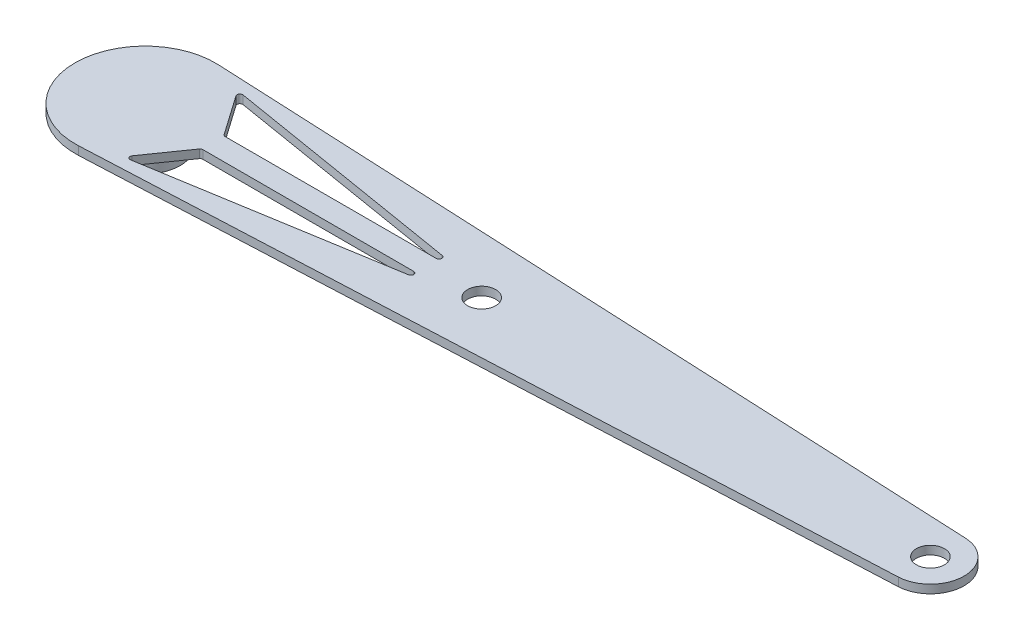
from build123d import *

# Parameters (mm, degrees)
SKETCH_1_R          = 12.5
SKETCH_1_R_2        = 3
EXTRUDE_1_DEPTH     = 10
SKETCH_2_R          = 1.6
CUT_EXTRUDE_4_DEPTH = 12.5
SKETCH_3_R          = 5
EXTRUDE_2_DEPTH     = 3
SKETCH_4_R          = 18
EXTRUDE_3_DEPTH     = 2.5
FILLET_1_R          = 1
SKETCH_5_R          = 1
CUT_EXTRUDE_5_DEPTH = 3
FILLET_2_R          = 1


with BuildPart() as part:
    # 草图1 → 凸台-拉伸1 (new body)
    with BuildSketch(Plane(origin=(0, 0, 0), x_dir=(1, 0, 0), z_dir=(0, 1, 0))):
        with Locations(Location((0, 0, 0), (0, 0, 270))):
            Circle(SKETCH_1_R)
        with Locations(Location((0, 0, 0), (0, 0, 270))):
            Circle(SKETCH_1_R_2, mode=Mode.SUBTRACT)
    extrude(amount=EXTRUDE_1_DEPTH)

    # 草图2 → 切除-拉伸4 (cut, symmetric)
    with BuildSketch(Plane.XY):
        with Locations((0, 5)):
            Circle(SKETCH_2_R)
    extrude(amount=CUT_EXTRUDE_4_DEPTH, both=True, mode=Mode.SUBTRACT)

    # 草图3 → 凸台-拉伸2 (add)
    with BuildSketch(Plane(origin=(0, 10, 0), x_dir=(1, 0, 0), z_dir=(0, 1, 0))):
        with BuildLine():
            Line((1.160714286, 24.97304031), (280.557142857, 11.987059349))
            ThreePointArc((280.557142857, 11.987059349), (292, 0), (280.557142857, -11.987059349))
            Line((280.557142857, -11.987059349), (1.160714286, -24.97304031))
            ThreePointArc((1.160714286, -24.97304031), (-25, 0), (1.160714286, 24.97304031))
        make_face()
        with Locations(Location((280, 0, 0), (0, 0, 270))):
            Circle(SKETCH_3_R, mode=Mode.SUBTRACT)
        with Locations(Location((120, 0, 0), (0, 0, 270))):
            Circle(SKETCH_3_R, mode=Mode.SUBTRACT)
    extrude(amount=EXTRUDE_2_DEPTH)

    # 草图4 → 凸台-拉伸3 (add)
    with BuildSketch(Plane.XZ.offset(-10)):
        with Locations(Location((0, 0, 0), (0, 0, 270))):
            Circle(SKETCH_4_R)
    extrude(amount=EXTRUDE_3_DEPTH)

    # 圆角1
    fillet_1_edges = [part.edges().sort_by_distance(p)[0] for p in [
        (0, 7.5, 18),
    ]]
    fillet(fillet_1_edges, radius=FILLET_1_R)

    # 草图5 → 切除-拉伸5 (cut)
    with BuildSketch(Plane.XZ.offset(-10)):
        with Locations((120, 0)):
            Circle(SKETCH_5_R)
        Polygon((24.0562108, 4), (111.937742252, 4), (12.545084957, 20.439591429), align=None)
        Polygon((12.545084957, -20.439591429), (24.0562108, -4), (111.937742252, -4), align=None)
    extrude(amount=-CUT_EXTRUDE_5_DEPTH, mode=Mode.SUBTRACT)

    # 圆角2
    fillet_2_edges = [part.edges().sort_by_distance(p)[0] for p in [
        (24.0562108, 11.5, 4),
        (12.545084957, 11.5, 20.439591429),
        (111.937742252, 11.5, 4),
        (111.937742252, 11.5, -4),
        (12.545084957, 11.5, -20.439591429),
        (24.0562108, 11.5, -4),
    ]]
    fillet(fillet_2_edges, radius=FILLET_2_R)


solid = part.part
